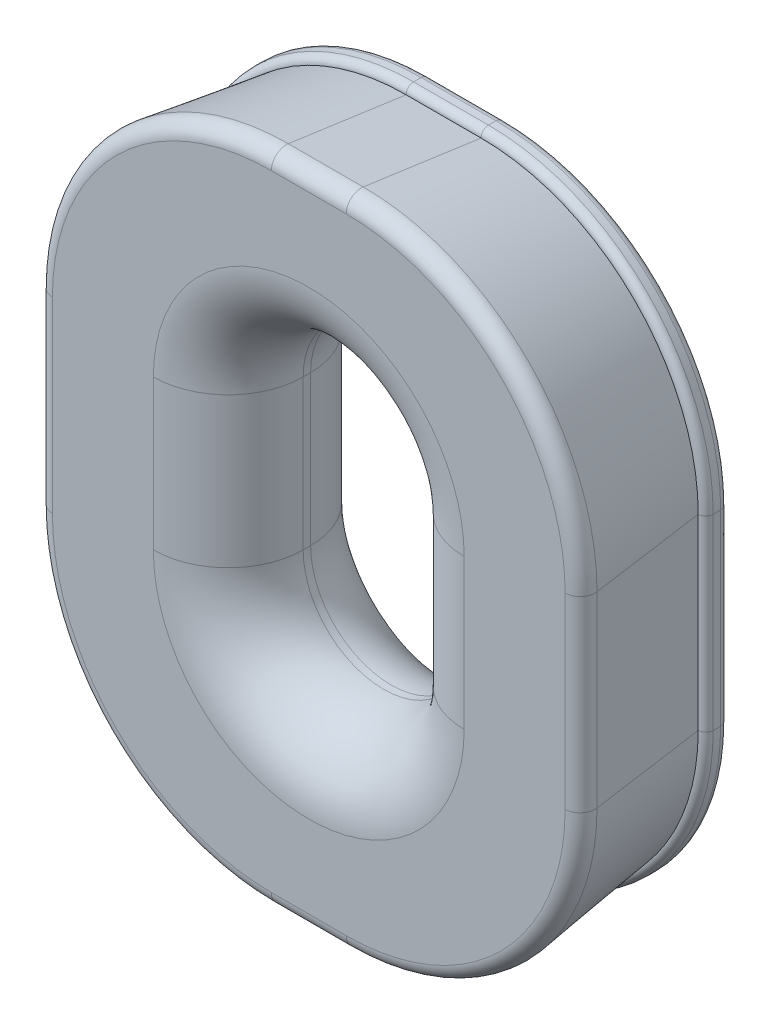
from build123d import *

# Parameters (mm, degrees)
BOSS_EXTRUDE1_DEPTH = 3
FILLET1_R           = 1
BOSS_EXTRUDE2_DEPTH = 18
BOSS_EXTRUDE2_DRAFT = -8
FILLET2_R           = 2
CUT_EXTRUDE1_DEPTH  = 61.545566409
FILLET4_R           = 10


with BuildPart() as part:
    # Sketch2 → Boss-Extrude1 (new body)
    with BuildSketch(Plane.XY):
        with BuildLine():
            Line((-5, -42.5), (5, -42.5))
            ThreePointArc((5, -42.5), (26.213203436, -33.713203436), (35, -12.5))
            Line((35, -12.5), (35, 12.5))
            ThreePointArc((35, 12.5), (26.213203436, 33.713203436), (5, 42.5))
            Line((5, 42.5), (-5, 42.5))
            ThreePointArc((-5, 42.5), (-26.213203436, 33.713203436), (-35, 12.5))
            Line((-35, 12.5), (-35, -12.5))
            ThreePointArc((-35, -12.5), (-26.213203436, -33.713203436), (-5, -42.5))
        make_face()
    extrude(amount=BOSS_EXTRUDE1_DEPTH)

    # Fillet1
    fillet1_edges = [part.edges().sort_by_distance(p)[0] for p in [
        (0, -42.5, 0),
        (-26.213203436, -33.713203436, 0),
        (-35, 0, 0),
        (-26.213203436, 33.713203436, 0),
        (-26.213203436, -33.713203436, 3),
        (0, -42.5, 3),
        (26.213203436, -33.713203436, 3),
        (35, 0, 3),
        (26.213203436, 33.713203436, 3),
        (0, 42.5, 3),
        (-26.213203436, 33.713203436, 3),
        (0, 42.5, 0),
        (-35, 0, 3),
        (26.213203436, 33.713203436, 0),
        (35, 0, 0),
        (26.213203436, -33.713203436, 0),
    ]]
    fillet(fillet1_edges, radius=FILLET1_R)


with BuildPart() as boss_extrude2_tool:
    # Sketch3 → Boss-Extrude2 (with draft: the straight prism first)
    with BuildSketch(Plane.XY.offset(3)):
        with BuildLine():
            Line((5, 41.5), (-5, 41.5))
            ThreePointArc((-5, 41.5), (-25.506096654, 33.006096654), (-34, 12.5))
            Line((-34, 12.5), (-34, -12.5))
            ThreePointArc((-34, -12.5), (-25.506096654, -33.006096654), (-5, -41.5))
            Line((-5, -41.5), (5, -41.5))
            ThreePointArc((5, -41.5), (25.506096654, -33.006096654), (34, -12.5))
            Line((34, -12.5), (34, 12.5))
            ThreePointArc((34, 12.5), (25.506096654, 33.006096654), (5, 41.5))
        make_face()
    extrude(amount=BOSS_EXTRUDE2_DEPTH)
    # Boss-Extrude2: the draft: its side faces are tilted about the plane it starts from
    boss_extrude2_sides = [boss_extrude2_tool.faces().sort_by_distance(p)[0] for p in [
        (-25.506096654, -33.006096654, 12),
        (0, -41.5, 12),
        (25.506096654, -33.006096654, 12),
        (34, 0, 12),
        (25.506096654, 33.006096654, 12),
        (0, 41.5, 12),
        (-25.506096654, 33.006096654, 12),
        (-34, 0, 12),
    ]]
    draft(boss_extrude2_sides, Plane.XY.offset(3), BOSS_EXTRUDE2_DRAFT)


with BuildPart() as part_1:
    add(part.part)

    # Boss-Extrude2: add boss_extrude2_tool
    add(boss_extrude2_tool.part)

    # Fillet2
    fillet2_edges = [part_1.edges().sort_by_distance(p)[0] for p in [
        (27.294889445, 34.794889445, 21),
        (0, 44.029735025, 21),
        (-27.294889445, 34.794889445, 21),
        (-36.529735025, 0, 21),
        (-27.294889445, -34.794889445, 21),
        (0, -44.029735025, 21),
        (27.294889445, -34.794889445, 21),
        (36.529735025, 0, 21),
    ]]
    fillet(fillet2_edges, radius=FILLET2_R)

    # Sketch5 → Cut-Extrude1 (cut, through all)
    with BuildSketch(Plane.XY.offset(21)):
        with BuildLine():
            Line((-10.75208941, -10), (-10.75208941, 10))
            ThreePointArc((-10.75208941, 10), (0, 20.75208941), (10.75208941, 10))
            Line((10.75208941, 10), (10.75208941, -10))
            ThreePointArc((10.75208941, -10), (0, -20.75208941), (-10.75208941, -10))
        make_face()
    extrude(amount=-CUT_EXTRUDE1_DEPTH, mode=Mode.SUBTRACT)

    # Fillet4
    fillet4_edges = [part_1.edges().sort_by_distance(p)[0] for p in [
        (0, -20.75208941, 0),
        (-10.75208941, 0, 0),
        (0, 20.75208941, 0),
        (10.75208941, 0, 0),
        (0, -20.75208941, 21),
        (10.75208941, 0, 21),
        (0, 20.75208941, 21),
        (-10.75208941, 0, 21),
    ]]
    fillet(fillet4_edges, radius=FILLET4_R)


solid = part_1.part
